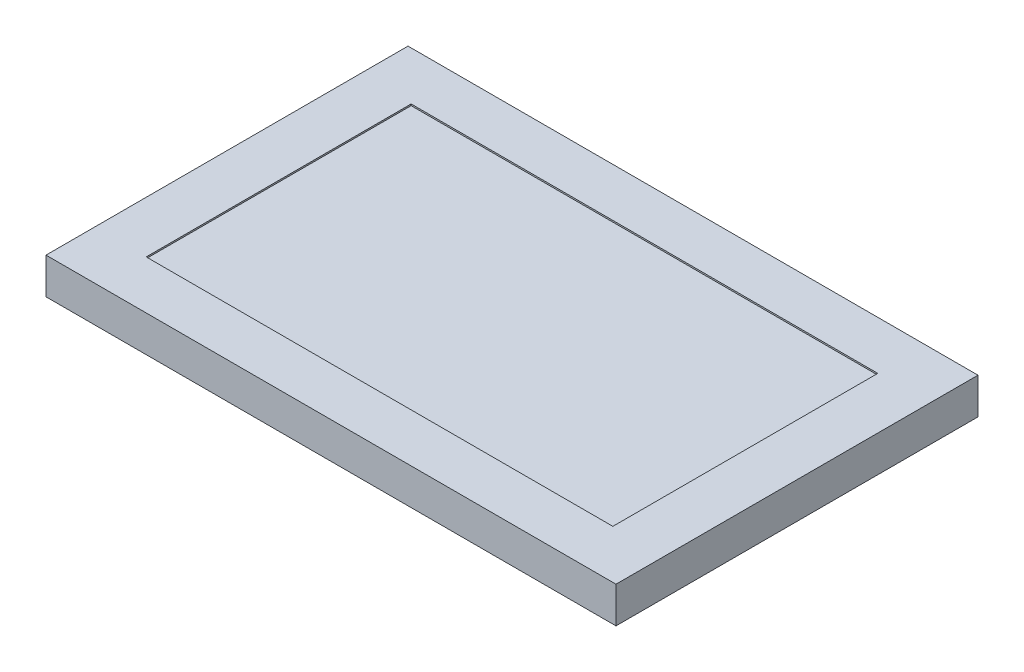
from build123d import *

# Parameters (mm, degrees)
SK_BODY_W            = 189.32
SK_BODY_H            = 120.24
EX_BODY_DEPTH        = 12
SK_ACTIVEAREA_W      = 155
SK_ACTIVEAREA_H      = 88
CUT_ACTIVEAREA_DEPTH = 0.5


with BuildPart() as part:
    # SK_Body → EX_Body (new body)
    with BuildSketch(Plane(origin=(0, 0, 0), x_dir=(1, 0, 0), z_dir=(0, 1, 0))):
        Rectangle(SK_BODY_W, SK_BODY_H)
    extrude(amount=EX_BODY_DEPTH)

    # SK_ActiveArea → CUT_ActiveArea (cut)
    with BuildSketch(Plane(origin=(0, 12, 0), x_dir=(1, 0, 0), z_dir=(0, 1, 0))):
        Rectangle(SK_ACTIVEAREA_W, SK_ACTIVEAREA_H)
    extrude(amount=-CUT_ACTIVEAREA_DEPTH, mode=Mode.SUBTRACT)


solid = part.part
